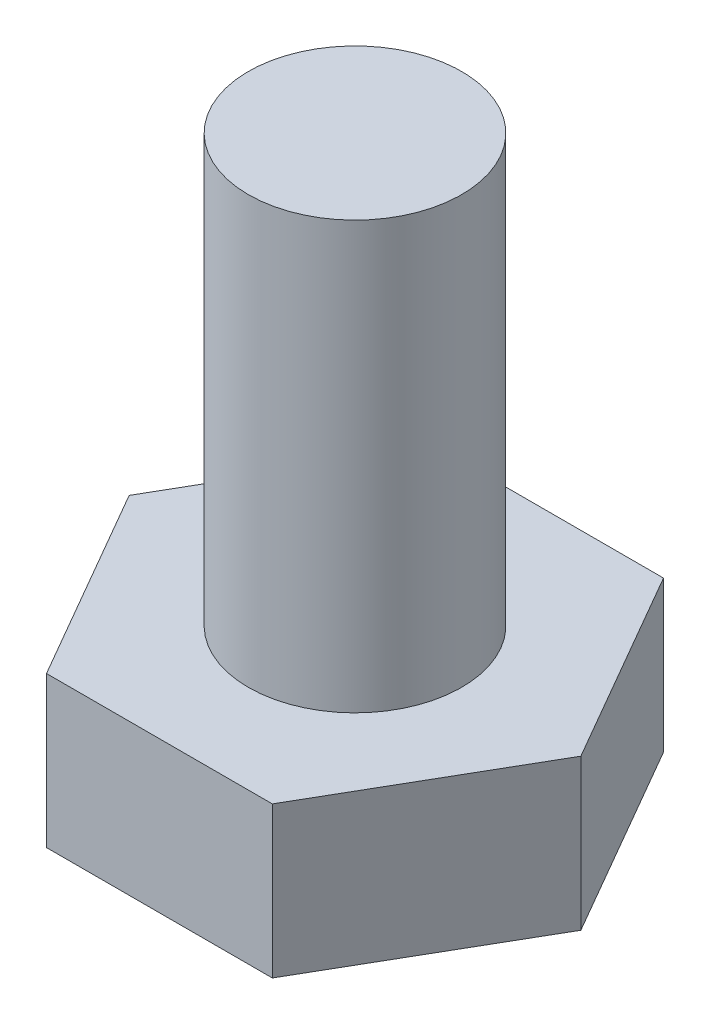
from build123d import *

# Parameters (mm, degrees)
SKETCH_1_R      = 1.5
EXTRUDE_1_DEPTH = 6
EXTRUDE_2_DEPTH = 2.12


with BuildPart() as part:
    # 草图1 → 凸台-拉伸1 (new body)
    with BuildSketch(Plane(origin=(0, 0, 0), x_dir=(1, 0, 0), z_dir=(0, 1, 0))):
        with Locations(Location((0, 0, 0), (0, 0, 270))):
            Circle(SKETCH_1_R)
    extrude(amount=EXTRUDE_1_DEPTH)

    # 草图3 → 凸台-拉伸2 (add)
    with BuildSketch(Plane.XZ):
        Polygon((3.175426481, 0), (1.58771324, 2.75), (-1.58771324, 2.75), (-3.175426481, 0), (-1.58771324, -2.75), (1.58771324, -2.75), align=None)
    extrude(amount=EXTRUDE_2_DEPTH)


solid = part.part
